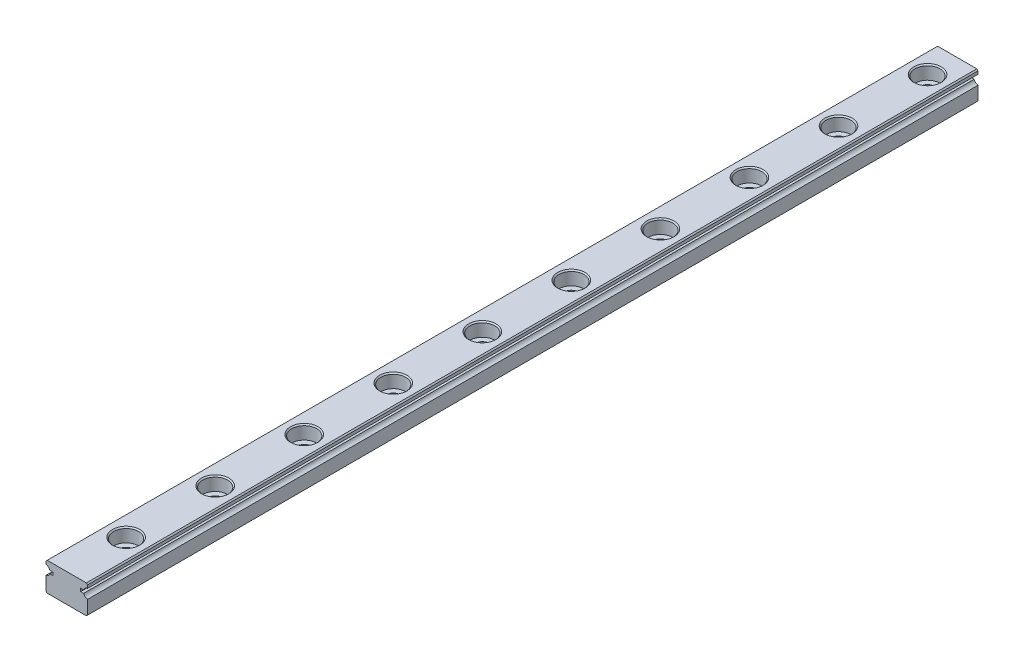
from build123d import *

# Parameters (mm, degrees)
EXTRUDE1_DEPTH             = 150
EXTRUDE2_REACH             = 152.118
SKETCH2_R                  = 1.2
SKETCH_R                   = 2.1
SKETCH_R_2                 = 1.2
EXTRUDE4_DEPTH             = 2.3
CHAMFER1_SIZE              = 0.2
LPATTERN1_COUNT            = 10
LPATTERN1_PITCH            = 15
CHAMFER1_OF_LPATTERN1_SIZE = 0.2


with BuildPart() as part:
    # Sketch1 → Extrude1 (new body)
    with BuildSketch(Plane.XY):
        with BuildLine():
            Line((-3.3, -2.4), (3.3, -2.4))
            Line((3.3, -2.4), (3.5, -2.2))
            Line((3.5, -2.2), (3.5, 0.106274607))
            ThreePointArc((3.5, 0.106274607), (3.091294745, 0.282570681), (2.840065792, 0.65))
            Line((2.840065792, 0.65), (2.340065792, 0.65))
            Line((2.340065792, 0.65), (2.340065792, 1.15))
            Line((2.340065792, 1.15), (2.840065792, 1.15))
            ThreePointArc((2.840065792, 1.15), (3.091294745, 1.517429319), (3.5, 1.693725393))
            Line((3.5, 1.693725393), (3.5, 2.2))
            Line((3.5, 2.2), (3.3, 2.4))
            Line((3.3, 2.4), (-3.3, 2.4))
            Line((-3.3, 2.4), (-3.5, 2.2))
            Line((-3.5, 2.2), (-3.5, 1.693725393))
            ThreePointArc((-3.5, 1.693725393), (-3.091294745, 1.517429319), (-2.840065792, 1.15))
            Line((-2.840065792, 1.15), (-2.340065792, 1.15))
            Line((-2.340065792, 1.15), (-2.340065792, 0.65))
            Line((-2.340065792, 0.65), (-2.840065792, 0.65))
            ThreePointArc((-2.840065792, 0.65), (-3.091294745, 0.282570681), (-3.5, 0.106274607))
            Line((-3.5, 0.106274607), (-3.5, -2.2))
            Line((-3.5, -2.2), (-3.3, -2.4))
        make_face()
    extrude(amount=EXTRUDE1_DEPTH)

    # Sketch2 → Extrude2 (cut, up to next)
    with BuildSketch(Plane(origin=(0, 2.4, 0), x_dir=(1, 0, 0), z_dir=(0, 1, 0)), mode=Mode.PRIVATE) as extrude2_sk1:
        with Locations((0, -5)):
            Circle(SKETCH2_R)
    extrude2_tool1 = extrude(extrude2_sk1.sketch, amount=-EXTRUDE2_REACH, mode=Mode.PRIVATE) & part.part
    extrude2 = extrude2_tool1.solids().sort_by_distance((0, 2.4, 5))[0]
    add(extrude2, mode=Mode.SUBTRACT)

    # Sketch → Extrude4 (cut)
    with BuildSketch(Plane(origin=(0, 2.4, 0), x_dir=(1, 0, 0), z_dir=(0, 1, 0))):
        with Locations((0, -5)):
            Circle(SKETCH_R)
        with Locations((0, -5)):
            Circle(SKETCH_R_2, mode=Mode.SUBTRACT)
    extrude4 = extrude(amount=-EXTRUDE4_DEPTH, mode=Mode.SUBTRACT)

    # Chamfer1
    chamfer1_edges = [part.edges().sort_by_distance(p)[0] for p in [
        (-1.2, -2.4, 5),
        (-2.1, 2.4, 5),
    ]]
    chamfer(chamfer1_edges, length=CHAMFER1_SIZE)

    # LPattern1: Extrude2, Extrude4 ×10
    with Locations(*[(0, 0, i * LPATTERN1_PITCH) for i in range(1, LPATTERN1_COUNT)]):
        add(extrude2, mode=Mode.SUBTRACT)
        add(extrude4, mode=Mode.SUBTRACT)

    # Chamfer1 of LPattern1
    chamfer1_of_lpattern1_edges = [part.edges().sort_by_distance(p)[0] for p in [
        (-1.2, -2.4, 20),
        (-2.1, 2.4, 20),
        (-1.2, -2.4, 35),
        (-2.1, 2.4, 35),
        (-1.2, -2.4, 50),
        (-2.1, 2.4, 50),
        (-1.2, -2.4, 65),
        (-2.1, 2.4, 65),
        (-1.2, -2.4, 80),
        (-2.1, 2.4, 80),
        (-1.2, -2.4, 95),
        (-2.1, 2.4, 95),
        (-1.2, -2.4, 110),
        (-2.1, 2.4, 110),
        (-1.2, -2.4, 125),
        (-2.1, 2.4, 125),
        (-1.2, -2.4, 140),
        (-2.1, 2.4, 140),
    ]]
    chamfer(chamfer1_of_lpattern1_edges, length=CHAMFER1_OF_LPATTERN1_SIZE)


solid = part.part
